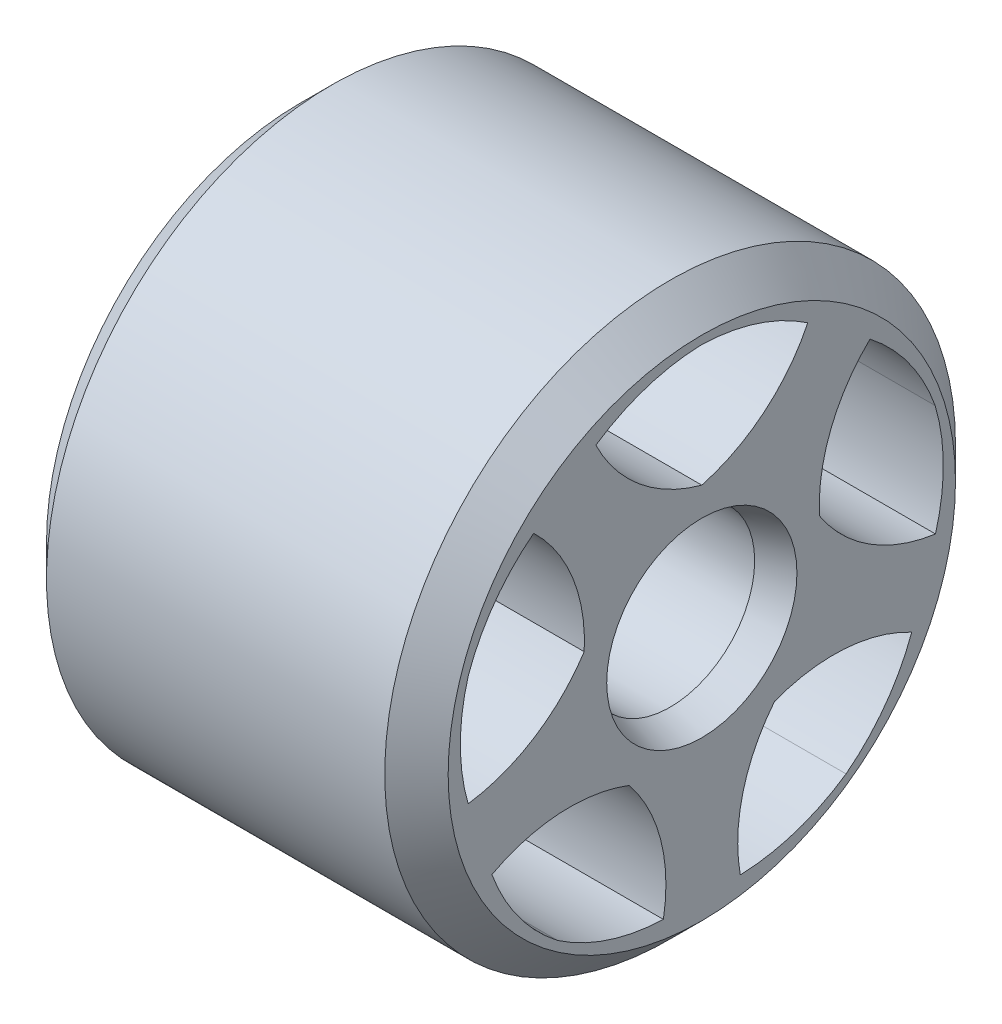
from build123d import *

# Parameters (mm, degrees)
SKETCH1_R           = 13.5
SKETCH1_R_2         = 4
BOSS_EXTRUDE1_DEPTH = 9.5
CUT_EXTRUDE1_DEPTH  = 22.324868112
CIRPATTERN1_COUNT   = 5
CHAMFER1_SIZE       = 1.5
CHAMFER2_SIZE       = 0.5
CHAMFER2_SIZE2      = 1.5


with BuildPart() as part:
    # Sketch1 → Boss-Extrude1 (new, symmetric)
    with BuildSketch(Plane(origin=(0, 0, 0), x_dir=(0, 0, -1), z_dir=(1, 0, 0))):
        Circle(SKETCH1_R)
        Circle(SKETCH1_R_2, mode=Mode.SUBTRACT)
    extrude(amount=BOSS_EXTRUDE1_DEPTH, both=True)

    # Sketch2 → Cut-Extrude1 (cut, symmetric)
    with BuildSketch(Plane(origin=(0, 0, 0), x_dir=(0, 0, -1), z_dir=(1, 0, 0))):
        with BuildLine():
            ThreePointArc((0, 5.849695328), (-2.956289657, 7.377375059), (-5.012219469, 9.99397715))
            ThreePointArc((-5.012219469, 9.99397715), (-2.621563936, 11.159720287), (0, 11.6087119))
            ThreePointArc((0, 11.6087119), (2.621563936, 11.159720287), (5.012219469, 9.99397715))
            ThreePointArc((5.012219469, 9.99397715), (2.956289657, 7.377375059), (0, 5.849695328))
        make_face()
    cut_extrude1 = extrude(amount=CUT_EXTRUDE1_DEPTH, both=True, mode=Mode.SUBTRACT)

    # CirPattern1: Cut-Extrude1 ×5 about axis
    cirpattern1_axis = Axis((0, 0, 0), (1, 0, 0))
    for i in range(1, CIRPATTERN1_COUNT):
        add(cut_extrude1.rotate(cirpattern1_axis, i * 360 / CIRPATTERN1_COUNT), mode=Mode.SUBTRACT)

    # Chamfer1
    chamfer1_edges = [part.edges().sort_by_distance(p)[0] for p in [
        (-9.5, 0, 13.5),
        (9.5, 0, 13.5),
    ]]
    chamfer(chamfer1_edges, length=CHAMFER1_SIZE)

    # Chamfer2
    chamfer2_edges = [part.edges().sort_by_distance(p)[0] for p in [
        (9.5, 0, 4),
    ]]
    chamfer2_side = [part.faces().sort_by_distance(p)[0] for p in [
        (9.5, 0, 11.660588745),
    ]]
    chamfer(chamfer2_edges, length=CHAMFER2_SIZE, length2=CHAMFER2_SIZE2, reference=chamfer2_side[0])


solid = part.part
